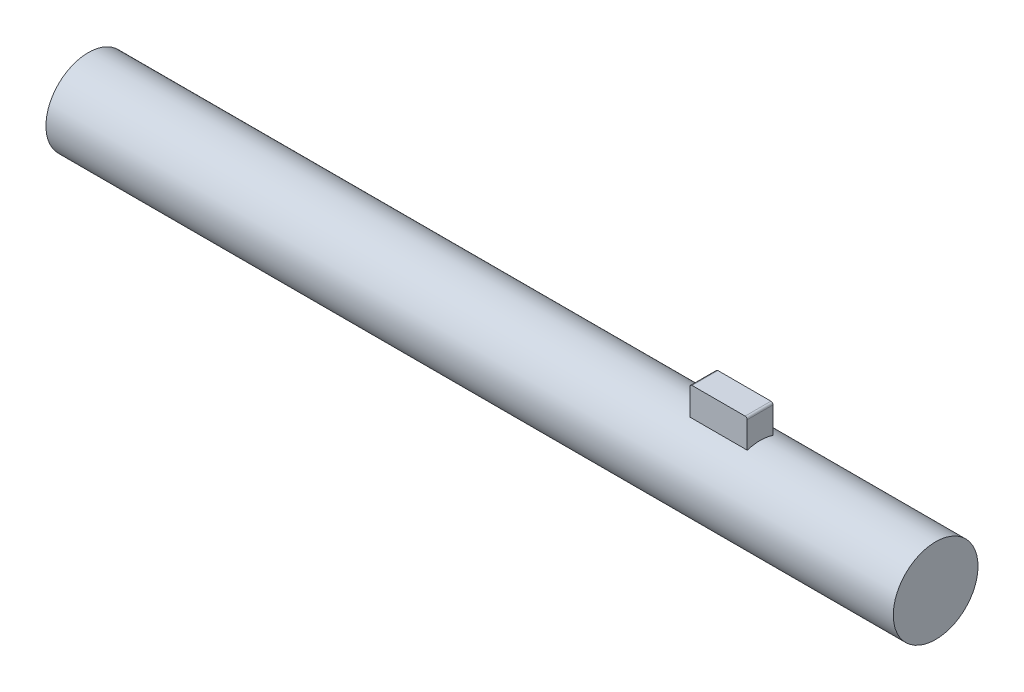
from build123d import *

# Parameters (mm, degrees)
SKETCH1_R                            = 4
BOSS_EXTRUDE1_DEPTH                  = 80
SKETCH2_W                            = 5.405623026
SKETCH2_H                            = 2.438582992
BOSS_EXTRUDE3_DEPTH                  = 2.5
BOSS_EXTRUDE3_DIRECTION_2_REACH      = 82.498
BOSS_EXTRUDE3_DIRECTION_2_END_RADIUS = 4
FILLET2_R                            = 0.2


with BuildPart() as part:
    # Sketch1 → Boss-Extrude1 (new body)
    with BuildSketch(Plane(origin=(0, 0, 0), x_dir=(0, 0, -1), z_dir=(1, 0, 0))):
        Circle(SKETCH1_R)
    extrude(amount=BOSS_EXTRUDE1_DEPTH)

    # Sketch2 → Boss-Extrude3 (add)
    with BuildSketch(Plane(origin=(0, 4, 0), x_dir=(1, 0, 0), z_dir=(0, 1, 0))):
        with Locations((60.729644263, 0)):
            Rectangle(SKETCH2_W, SKETCH2_H)
    extrude(amount=BOSS_EXTRUDE3_DEPTH)

    # Boss-Extrude3 direction 2: up to this cylinder (the profile starts outside it)
    boss_extrude3_direction_2_end = Plane(origin=(60.729644, 0, 0), z_dir=(-1, 0, 0)) * Cylinder(BOSS_EXTRUDE3_DIRECTION_2_END_RADIUS, 173.996, mode=Mode.PRIVATE)
    # Sketch2 → Boss-Extrude3 direction 2 (add, up to the surface)
    with BuildSketch(Plane(origin=(0, 4, 0), x_dir=(1, 0, 0), z_dir=(0, 1, 0)), mode=Mode.PRIVATE) as boss_extrude3_direction_2_sk1:
        with Locations((60.729644263, 0)):
            Rectangle(SKETCH2_W, SKETCH2_H)
    boss_extrude3_direction_2_tool1 = extrude(boss_extrude3_direction_2_sk1.sketch, amount=-BOSS_EXTRUDE3_DIRECTION_2_REACH, mode=Mode.PRIVATE) - boss_extrude3_direction_2_end
    add(boss_extrude3_direction_2_tool1.solids().sort_by_distance((60.729644, 4, 0))[0])
    add(boss_extrude3_direction_2_tool1.solids().sort_by_distance((60.729644, 4, 0))[1])

    # Fillet2
    fillet2_edges = [part.edges().sort_by_distance(p)[0] for p in [
        (63.432455776, 6.5, 0),
        (58.02683275, 6.5, 0),
    ]]
    fillet(fillet2_edges, radius=FILLET2_R)


solid = part.part
